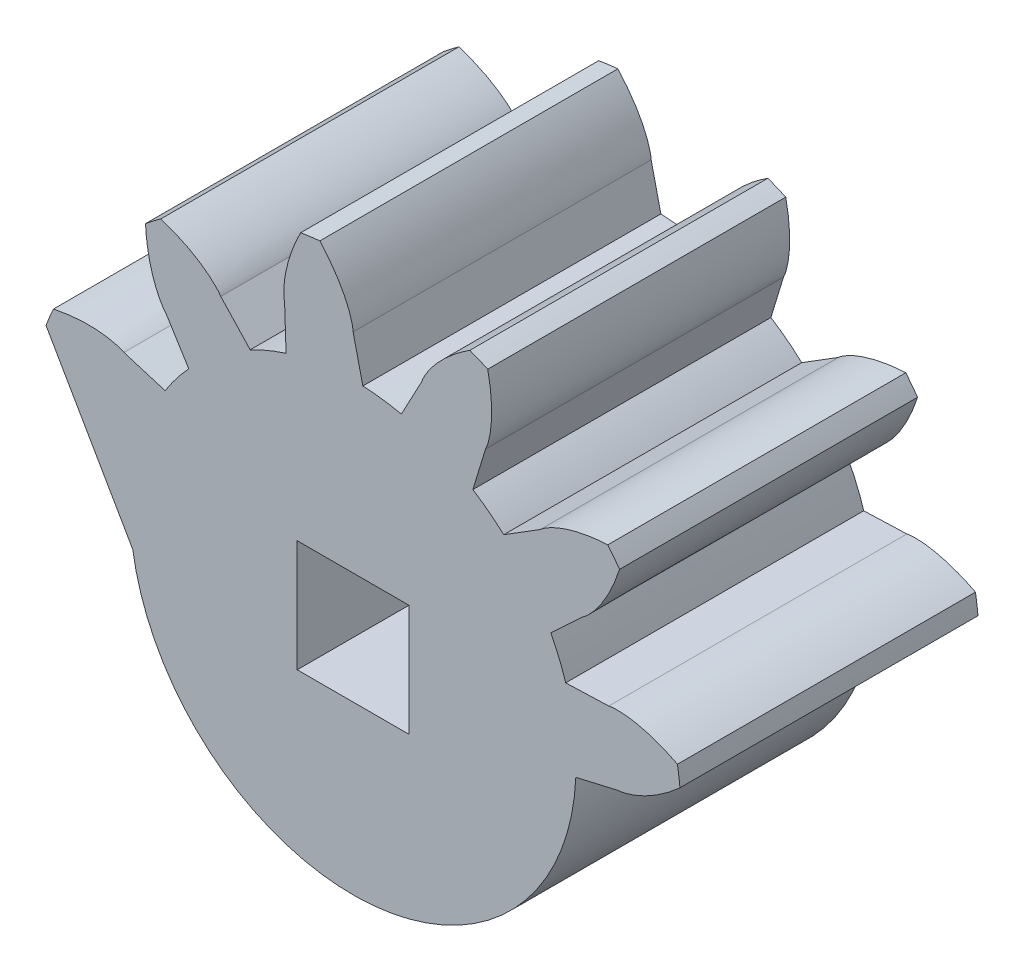
from build123d import *

# Parameters (mm, degrees)
SKETCH1_R           = 14
SKETCH1_W           = 4.7625
SKETCH1_H           = 4.7625
BOSS_EXTRUDE1_DEPTH = 12.7
CUT_EXTRUDE2_DEPTH  = 12.7
CIRPATTERN1_COUNT   = 12
CUT_EXTRUDE3_DEPTH  = 12.7
BOSS_EXTRUDE2_DEPTH = 12.7


with BuildPart() as part:
    # Sketch1 → Boss-Extrude1 (new body)
    with BuildSketch(Plane.XY):
        Circle(SKETCH1_R)
        Rectangle(SKETCH1_W, SKETCH1_H, mode=Mode.SUBTRACT)
    extrude(amount=BOSS_EXTRUDE1_DEPTH)

    # Sketch2 → Cut-Extrude2 (cut)
    with BuildSketch(Plane.XY.offset(12.7)):
        with BuildLine():
            Line((9.765735466, 5.63825), (8.425772987, 4.386040421))
            ThreePointArc((8.425772987, 4.386040421), (8.775931679, 3.635109924), (9.05932014, 2.856522291))
            Line((9.05932014, 2.856522291), (10.89226258, 2.918572962))
            add(Edge.make_bspline(
                [(10.89226258, 2.918572962), (10.926225774, 2.926110483), (11.022290818, 2.942700204), (11.208093043, 2.95599604), (11.510593122, 2.951165366), (11.900233077, 2.905990048), (12.393614042, 2.803046766), (12.953297572, 2.62879349), (13.387020142, 2.449311198), (13.697491187, 2.299105356), (13.848549614, 2.220883572)],
                knots=[0, 0, 0, 0, 0, 0.005604071, 0.015718253, 0.029959921, 0.048733673, 0.068727069, 0.096888899, 0.124316379, 0.124316379, 0.124316379, 0.124316379, 0.124316379], degree=4))
            ThreePointArc((13.848549614, 2.220883572), (12.957872383, 5.367326481), (11.362805176, 8.222001507))
            add(Edge.make_bspline(
                [(9.765735466, 5.63825), (9.795080903, 5.656935773), (9.874739851, 5.713133312), (10.01552344, 5.835113749), (10.226007495, 6.052429409), (10.469580775, 6.359890238), (10.745661909, 6.781555156), (11.018202255, 7.300526849), (11.197977279, 7.734128165), (11.311301892, 8.059875916), (11.362805176, 8.222001507)],
                knots=[0, 0, 0, 0, 0, 0.005604071, 0.015718253, 0.029959921, 0.048733673, 0.068727069, 0.096888899, 0.124316379, 0.124316379, 0.124316379, 0.124316379, 0.124316379], degree=4))
        make_face()
    cut_extrude2 = extrude(amount=-CUT_EXTRUDE2_DEPTH, mode=Mode.SUBTRACT)

    # CirPattern1: Cut-Extrude2 ×12 about axis
    cirpattern1_axis = Axis((0, 0, 12.7), (0, 0, -1))
    for i in range(1, CIRPATTERN1_COUNT):
        add(cut_extrude2.rotate(cirpattern1_axis, i * 360 / CIRPATTERN1_COUNT), mode=Mode.SUBTRACT)

    # Sketch4 → Cut-Extrude3 (cut)
    with BuildSketch(Plane.XY.offset(12.7)):
        with BuildLine():
            Line((-9.431447157, 1.130842839), (-13.900437961, 1.666680677))
            ThreePointArc((-13.900437961, 1.666680677), (-1.645492098, -13.902962122), (13.905453984, -1.624299696))
            Line((13.905453984, -1.624299696), (9.434850528, -1.102087344))
            ThreePointArc((9.434850528, -1.102087344), (-1.116466388, -9.4331598), (-9.431447157, 1.130842839))
        make_face()
    extrude(amount=-CUT_EXTRUDE3_DEPTH, mode=Mode.SUBTRACT)

    # Sketch5 → Boss-Extrude2 (add)
    with BuildSketch(Plane.XY.offset(12.7)):
        with BuildLine():
            Line((-13.086503174, 4.974277301), (-9.389446127, -1.445095645))
            Line((-9.389446127, -1.445095645), (-9.388388384, -1.445394253))
            ThreePointArc((-9.388388384, -1.445394253), (-9.484867836, -0.517960557), (-9.489953664, 0.414464066))
            ThreePointArc((-9.489953664, 0.414464066), (-9.417734738, 1.2398683), (-9.273862528, 2.055839199))
            Line((-9.273862528, 2.055839199), (-10.89226258, 2.918572962))
            add(Edge.make_bspline(
                [(-10.89226258, 2.918572962), (-10.925444329, 2.929026875), (-11.016933958, 2.962692277), (-11.184491323, 3.044078857), (-11.444048739, 3.199512383), (-11.75889918, 3.433455334), (-12.134707988, 3.769297313), (-12.526899585, 4.194215821), (-12.808483679, 4.559768992), (-12.998544728, 4.838012668), (-13.086503174, 4.974277301)],
                knots=[0, 0, 0, 0, 0, 0.005604071, 0.015718253, 0.029959921, 0.048733673, 0.068727069, 0.096888899, 0.123039083, 0.123039083, 0.123039083, 0.123039083, 0.123039083], degree=4))
        make_face()
    extrude(amount=-BOSS_EXTRUDE2_DEPTH)


solid = part.part
